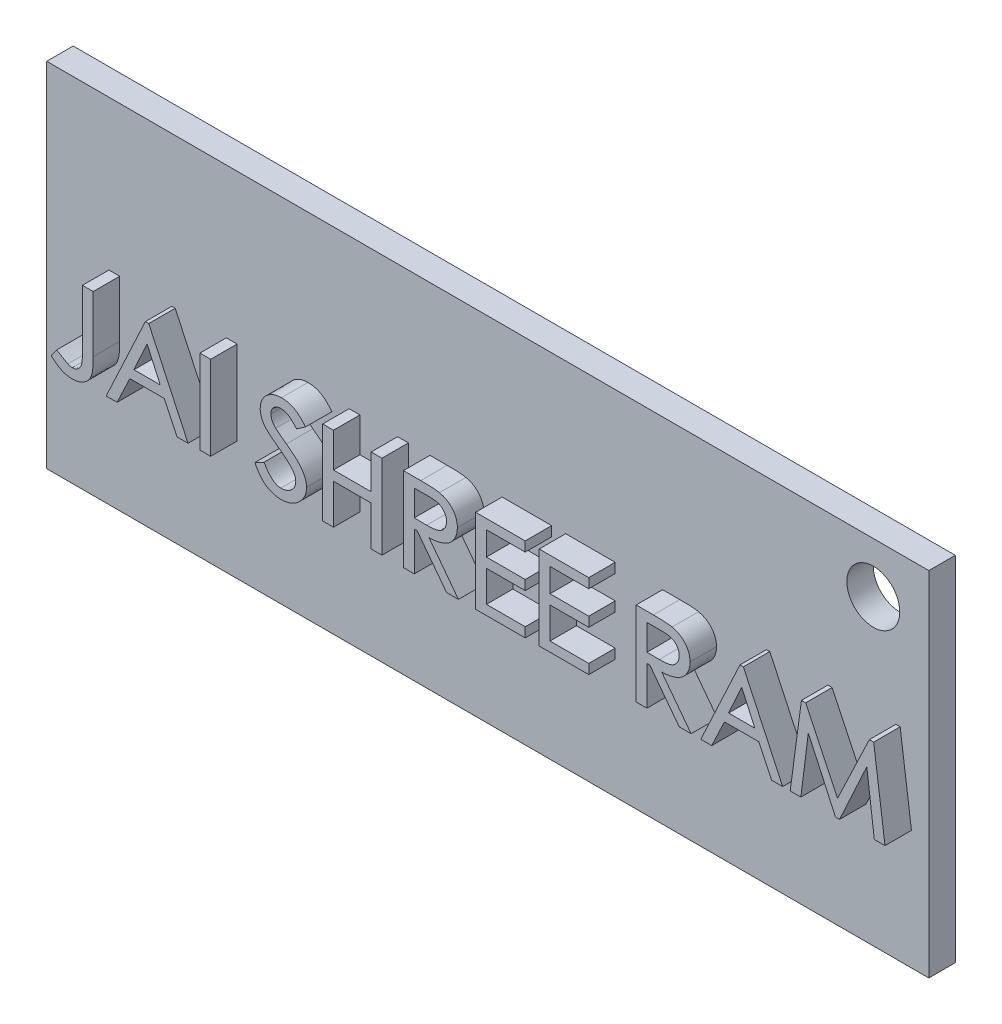
from build123d import *

# Parameters (mm, degrees)
SKETCH1_W           = 50
SKETCH1_H           = 20
BOSS_EXTRUDE1_DEPTH = 2
SKETCH2_W           = 0.610576923
SKETCH2_H           = 4.7625
BOSS_EXTRUDE2_DEPTH = 1.5
SKETCH3_R           = 1.5
CUT_EXTRUDE1_DEPTH  = 4.5
SKETCH4_W           = 50
SKETCH4_H           = 20
CUT_EXTRUDE2_DEPTH  = 0.5


with BuildPart() as part:
    # Sketch1 → Boss-Extrude1 (new body)
    with BuildSketch(Plane.XY):
        with Locations((25, 10)):
            Rectangle(SKETCH1_W, SKETCH1_H)
    extrude(amount=BOSS_EXTRUDE1_DEPTH)

    # Sketch2 → Boss-Extrude2 (add)
    # profile 1 of 11: a face of its own
    with BuildSketch(Plane.XY.offset(2)):
        with BuildLine():
            Line((3.527254375, 11.517482199), (4.137831298, 11.517482199))
            Line((4.137831298, 11.517482199), (4.137831298, 8.320539591))
            add(Edge.make_bspline(
                [(4.137831298, 8.320539591), (4.137369393, 8.262660957), (4.13648095, 8.151335463), (4.132416587, 7.99095202), (4.122616108, 7.844316911), (4.110067042, 7.710736069), (4.09603917, 7.590135007), (4.075453027, 7.483013293), (4.053433263, 7.388994498), (4.017799839, 7.282359586), (3.961605704, 7.162646856), (3.872103401, 7.033555286), (3.760947677, 6.918559061), (3.652980666, 6.834614431), (3.556960451, 6.776969252), (3.48065281, 6.737208328), (3.399393736, 6.704920072), (3.313923276, 6.679584233), (3.225148985, 6.658341294), (3.132109712, 6.642912946), (3.034817254, 6.634515846), (2.968528246, 6.633422865), (2.934803954, 6.632866814)],
                knots=[0, 0, 0, 0, 1.452672516, 2.794113746, 4.025812556, 5.140045592, 6.161674878, 7.071150553, 7.876425152, 8.583113845, 9.889795866, 11.180512384, 12.507055147, 13.889560834, 14.598589264, 15.316057477, 16.046722018, 16.789019803, 17.55176036, 18.336401437, 19.153650307, 20, 20, 20, 20], degree=3))
            add(Edge.make_bspline(
                [(2.934803954, 6.632866814), (2.887334041, 6.63402819), (2.792876699, 6.636339136), (2.652114658, 6.658874722), (2.512938035, 6.692590077), (2.372837363, 6.742528317), (2.228947091, 6.812574312), (2.079287645, 6.909339163), (1.918425168, 7.028562107), (1.812493314, 7.121751385), (1.756581298, 7.170937728)],
                knots=[0, 0, 0, 0, 0.856854487, 1.704999893, 2.568796624, 3.440919207, 4.38635173, 5.452546826, 6.655425746, 8, 8, 8, 8], degree=3))
            Line((1.756581298, 7.170937728), (2.05900768, 7.609789891))
            add(Edge.make_bspline(
                [(2.05900768, 7.609789891), (2.094243339, 7.587743898), (2.162260112, 7.545187655), (2.261397435, 7.485466107), (2.35258942, 7.430712574), (2.437087884, 7.383307051), (2.51313558, 7.340207095), (2.581538597, 7.302728568), (2.643201114, 7.272064266), (2.68195667, 7.253873889), (2.70011345, 7.24535179)],
                knots=[0, 0, 0, 0, 1.351848167, 2.609525467, 3.764319947, 4.811191365, 5.760578872, 6.607529217, 7.347634558, 8, 8, 8, 8], degree=3))
            add(Edge.make_bspline(
                [(2.70011345, 7.24535179), (2.722821183, 7.235590967), (2.766264683, 7.216916963), (2.83179995, 7.198545083), (2.892873988, 7.184540554), (2.932824875, 7.183084192), (2.95197643, 7.182386045)],
                knots=[0, 0, 0, 0, 1.133394633, 2.168363871, 3.121954873, 4, 4, 4, 4], degree=3))
            add(Edge.make_bspline(
                [(2.95197643, 7.182386045), (2.980397875, 7.183642245), (3.036693453, 7.186130453), (3.118702225, 7.206899704), (3.196239144, 7.240957048), (3.268787802, 7.287861682), (3.334339367, 7.346651255), (3.390420482, 7.416706798), (3.43665223, 7.496261044), (3.464964578, 7.571731165), (3.484408123, 7.640937826), (3.494500609, 7.705701261), (3.50548769, 7.781610418), (3.513940385, 7.869146009), (3.518917352, 7.968476668), (3.524056469, 8.07944528), (3.526725069, 8.201909455), (3.527073208, 8.287465715), (3.527254375, 8.331987908)],
                knots=[0, 0, 0, 0, 0.93789549, 1.85772999, 2.77510142, 3.725098534, 4.6996409, 5.670950193, 6.678238788, 7.725916441, 8.324833892, 9.050260382, 9.888218126, 10.859356959, 11.953767278, 13.173560852, 14.529163492, 16, 16, 16, 16], degree=3))
            Line((3.527254375, 8.331987908), (3.527254375, 11.517482199))
        make_face()
    # profile 2 of 11: a face of its own
    with BuildSketch(Plane.XY.offset(2)):
        Polygon((7.282302452, 11.517482199), (9.510908221, 6.754982199), (8.884112849, 6.754982199), (8.160960805, 8.281424506), (6.21283881, 8.281424506), (5.489686767, 6.754982199), (4.870523606, 6.754982199), (7.091497164, 11.517482199), align=None)
        Polygon((7.186899808, 10.47663935), (6.445621262, 8.830943737), (7.935810565, 8.830943737), align=None, mode=Mode.SUBTRACT)
    # profile 3 of 11: a face of its own
    with BuildSketch(Plane.XY.offset(2)):
        with Locations((10.487831299, 9.136232199)):
            Rectangle(SKETCH2_W, SKETCH2_H)
    # profile 4 of 11: a face of its own
    with BuildSketch(Plane.XY.offset(2)):
        with BuildLine():
            Line((13.296485144, 7.699468377), (13.815475529, 7.976136045))
            add(Edge.make_bspline(
                [(13.815475529, 7.976136045), (13.853297278, 7.913487235), (13.925585119, 7.793748002), (14.044285423, 7.632445041), (14.162305675, 7.494896007), (14.280810874, 7.381239783), (14.40144715, 7.293302025), (14.522982939, 7.22974757), (14.646178909, 7.189801482), (14.729475682, 7.184831282), (14.770455998, 7.182386045)],
                knots=[0, 0, 0, 0, 1.354943589, 2.589672558, 3.704607527, 4.708856974, 5.624398268, 6.459549776, 7.242129862, 8, 8, 8, 8], degree=3))
            add(Edge.make_bspline(
                [(14.770455998, 7.182386045), (14.808713328, 7.183615795), (14.884490093, 7.186051576), (14.995829279, 7.207175797), (15.103635091, 7.239361662), (15.206039454, 7.285193621), (15.300647019, 7.341343391), (15.384164702, 7.408131134), (15.455027128, 7.483744702), (15.513434194, 7.567158344), (15.559217138, 7.656218715), (15.592920412, 7.748398655), (15.612700871, 7.843963768), (15.615342261, 7.908310553), (15.616677452, 7.940837067)],
                knots=[0, 0, 0, 0, 1.0888553, 2.156709112, 3.216967111, 4.287545289, 5.343926646, 6.34269433, 7.323221176, 8.28571565, 9.233736345, 10.167849744, 11.073870434, 12, 12, 12, 12], degree=3))
            add(Edge.make_bspline(
                [(15.616677452, 7.940837067), (15.614806725, 7.977907025), (15.611026413, 8.052816933), (15.580684717, 8.164096495), (15.531373922, 8.274287239), (15.485760325, 8.343086273), (15.462125168, 8.378735204)],
                knots=[0, 0, 0, 0, 0.941861274, 1.903286225, 2.913566088, 4, 4, 4, 4], degree=3))
            add(Edge.make_bspline(
                [(15.462125168, 8.378735204), (15.441687758, 8.404685037), (15.398665274, 8.45931164), (15.325840411, 8.54155284), (15.240625764, 8.627342613), (15.143159563, 8.716293931), (15.035154972, 8.810399927), (14.914777355, 8.907228383), (14.782877697, 9.008415716), (14.690446078, 9.076300092), (14.642616454, 9.111427511)],
                knots=[0, 0, 0, 0, 0.718593868, 1.512701116, 2.388487339, 3.348232282, 4.383172848, 5.504845107, 6.708858268, 8, 8, 8, 8], degree=3))
            add(Edge.make_bspline(
                [(14.642616454, 9.111427511), (14.593842757, 9.146884412), (14.50025969, 9.214916277), (14.36840932, 9.314651305), (14.25019263, 9.406612528), (14.146516153, 9.490871822), (14.057368105, 9.568161532), (13.982936283, 9.638164504), (13.920979981, 9.698959673), (13.887686431, 9.739865515), (13.872717115, 9.758257439)],
                knots=[0, 0, 0, 0, 1.435833971, 2.754963323, 3.936484598, 5.002077172, 5.935979083, 6.744956812, 7.435712417, 8, 8, 8, 8], degree=3))
            add(Edge.make_bspline(
                [(13.872717115, 9.758257439), (13.850863938, 9.786493871), (13.807931613, 9.841966613), (13.753577804, 9.930948484), (13.706807568, 10.02109492), (13.668285344, 10.113240621), (13.63843294, 10.207091213), (13.617895897, 10.302975824), (13.603409424, 10.400513579), (13.602320843, 10.466409626), (13.601773606, 10.499535985)],
                knots=[0, 0, 0, 0, 1.064105702, 2.090521257, 3.104283852, 4.09061442, 5.065433238, 6.036507983, 7.012940167, 8, 8, 8, 8], degree=3))
            add(Edge.make_bspline(
                [(13.601773606, 10.499535985), (13.603496921, 10.551195989), (13.606908959, 10.653479017), (13.637400218, 10.802796916), (13.686811828, 10.945070206), (13.754258151, 11.079563557), (13.840385876, 11.2037735), (13.942831305, 11.315247028), (14.062148739, 11.41160551), (14.195154584, 11.49279773), (14.338519204, 11.55864516), (14.489515746, 11.605578193), (14.646313715, 11.634030659), (14.752847711, 11.637728191), (14.806709003, 11.639597583)],
                knots=[0, 0, 0, 0, 1.004530234, 1.988896367, 2.951881425, 3.928924249, 4.907494835, 5.884204368, 6.865296418, 7.88218147, 8.909671266, 9.927572845, 10.952225504, 12, 12, 12, 12], degree=3))
            add(Edge.make_bspline(
                [(14.806709003, 11.639597583), (14.867865426, 11.637408575), (14.988986018, 11.633073234), (15.167529157, 11.603693325), (15.338260262, 11.550796818), (15.475765326, 11.492408897), (15.582581607, 11.432711845), (15.663368946, 11.378795187), (15.746171802, 11.31777688), (15.828367563, 11.246615208), (15.913159773, 11.16875324), (15.99620639, 11.079958578), (16.082762996, 10.985320155), (16.137931008, 10.917069325), (16.166196683, 10.882100588)],
                knots=[0, 0, 0, 0, 1.360590218, 2.69465552, 4.010645498, 5.328858611, 6.009843139, 6.729980544, 7.488405022, 8.296451933, 9.147430815, 10.048128915, 10.999946711, 12, 12, 12, 12], degree=3))
            Line((16.166196683, 10.882100588), (15.66819488, 10.540559122))
            add(Edge.make_bspline(
                [(15.66819488, 10.540559122), (15.642205515, 10.56830873), (15.592234488, 10.621664262), (15.518728145, 10.69733056), (15.449181122, 10.765235654), (15.383382354, 10.825068901), (15.322806627, 10.87789735), (15.265751819, 10.921939615), (15.214002106, 10.959791942), (15.149310374, 10.997307774), (15.070003191, 11.034462896), (14.972394659, 11.067893982), (14.870007512, 11.085760843), (14.800728195, 11.088628073), (14.765685865, 11.090078353)],
                knots=[0, 0, 0, 0, 1.253377364, 2.409930098, 3.477532466, 4.457083962, 5.341772995, 6.126101147, 6.832963523, 7.453284126, 8.588253012, 9.715448048, 10.844445545, 12, 12, 12, 12], degree=3))
            add(Edge.make_bspline(
                [(14.765685865, 11.090078353), (14.72828192, 11.088330388), (14.655565595, 11.084932203), (14.551112408, 11.055832463), (14.455094678, 11.009914066), (14.37038012, 10.944927238), (14.29996803, 10.864490945), (14.24832921, 10.770270017), (14.21810875, 10.662892745), (14.214324105, 10.587504154), (14.212350529, 10.548191333)],
                knots=[0, 0, 0, 0, 1.033513523, 2.009234674, 2.977584268, 3.963375862, 4.942860848, 5.915719707, 6.913112236, 8, 8, 8, 8], degree=3))
            add(Edge.make_bspline(
                [(14.212350529, 10.548191333), (14.213119496, 10.522717892), (14.214655569, 10.471832623), (14.225938461, 10.396457071), (14.246794881, 10.323626407), (14.27322418, 10.251805534), (14.310216144, 10.181397997), (14.357327617, 10.112292619), (14.413253285, 10.042498477), (14.456174179, 9.998622517), (14.478523906, 9.975775468)],
                knots=[0, 0, 0, 0, 0.940834015, 1.879392378, 2.805520916, 3.734846727, 4.701501436, 5.734192883, 6.820151034, 8, 8, 8, 8], degree=3))
            add(Edge.make_bspline(
                [(14.478523906, 9.975775468), (14.489840525, 9.965129351), (14.515814539, 9.940694279), (14.563453669, 9.903276936), (14.621494523, 9.856365584), (14.690741754, 9.800725897), (14.773472367, 9.739378639), (14.866627519, 9.668225306), (14.972565906, 9.590469142), (15.047115046, 9.535956795), (15.08623875, 9.507348485)],
                knots=[0, 0, 0, 0, 0.485581606, 1.114511607, 1.892484918, 2.819534315, 3.891398566, 5.11240712, 6.484579029, 8, 8, 8, 8], degree=3))
            add(Edge.make_bspline(
                [(15.08623875, 9.507348485), (15.139540385, 9.468497049), (15.242654255, 9.393337592), (15.389131047, 9.279969443), (15.521232426, 9.168840772), (15.642298231, 9.063828599), (15.748234223, 8.96052787), (15.841025284, 8.861062572), (15.921836694, 8.766403562), (16.00814425, 8.645715972), (16.094434505, 8.496928909), (16.171595827, 8.317091787), (16.217640407, 8.135835962), (16.224077319, 8.014858234), (16.227254375, 7.955147463)],
                knots=[0, 0, 0, 0, 1.186540699, 2.295404303, 3.331123753, 4.291760032, 5.17774712, 5.991329992, 6.738459906, 7.414799035, 8.65800623, 9.82461674, 10.926299804, 12, 12, 12, 12], degree=3))
            add(Edge.make_bspline(
                [(16.227254375, 7.955147463), (16.22590255, 7.912783542), (16.223215693, 7.828582009), (16.203735241, 7.704084653), (16.171321482, 7.583077493), (16.124688417, 7.466071502), (16.066523258, 7.351968548), (15.994402352, 7.241766191), (15.908560774, 7.135889084), (15.81262004, 7.033697451), (15.706533811, 6.939779355), (15.592768374, 6.857119044), (15.471671064, 6.78806508), (15.344175044, 6.732039775), (15.211028401, 6.68638611), (15.070915339, 6.655117168), (14.924528839, 6.637068273), (14.824885458, 6.634282058), (14.774272103, 6.632866814)],
                knots=[0, 0, 0, 0, 0.932646097, 1.853705421, 2.767602683, 3.685675702, 4.622099834, 5.5835355, 6.579838097, 7.620108014, 8.666886363, 9.695041649, 10.711275682, 11.730160242, 12.757671447, 13.80585424, 14.885494678, 16, 16, 16, 16], degree=3))
            add(Edge.make_bspline(
                [(14.774272103, 6.632866814), (14.73736427, 6.633686584), (14.6646711, 6.635301192), (14.556752446, 6.645542939), (14.451734154, 6.665227475), (14.349040442, 6.690677597), (14.248607218, 6.723084891), (14.151728788, 6.764539761), (14.056791902, 6.812156409), (13.964341164, 6.86791057), (13.87425868, 6.933194304), (13.786032525, 7.008975878), (13.700175182, 7.096587439), (13.615214874, 7.194890728), (13.532274039, 7.304991455), (13.451546311, 7.426310673), (13.372000943, 7.558457163), (13.322153222, 7.651538184), (13.296485144, 7.699468377)],
                knots=[0, 0, 0, 0, 0.916943493, 1.805999526, 2.689245248, 3.568702553, 4.433092864, 5.307568578, 6.183755457, 7.069823058, 7.986358083, 8.944343836, 9.955449961, 11.030835633, 12.170024038, 13.377301724, 14.649494474, 16, 16, 16, 16], degree=3))
        make_face()
    # profile 5 of 11: a face of its own
    with BuildSketch(Plane.XY.offset(2)):
        Polygon((17.14311976, 11.517482199), (17.753696683, 11.517482199), (17.753696683, 9.563636045), (19.890715914, 9.563636045), (19.890715914, 11.517482199), (20.501292837, 11.517482199), (20.501292837, 6.754982199), (19.890715914, 6.754982199), (19.890715914, 9.014116814), (17.753696683, 9.014116814), (17.753696683, 6.754982199), (17.14311976, 6.754982199), align=None)
    # profile 6 of 11: a face of its own
    with BuildSketch(Plane.XY.offset(2)):
        with BuildLine():
            Line((21.722446683, 11.517482199), (22.697461707, 11.517482199))
            add(Edge.make_bspline(
                [(22.697461707, 11.517482199), (22.760111442, 11.517330717), (22.880011801, 11.517040808), (23.052059316, 11.513998608), (23.208273882, 11.509969483), (23.348773564, 11.501553226), (23.473934602, 11.494124319), (23.583215655, 11.481905848), (23.677131227, 11.471008294), (23.733596175, 11.459018797), (23.759293137, 11.453562427)],
                knots=[0, 0, 0, 0, 1.411347063, 2.701065231, 3.876524531, 4.931206492, 5.871916627, 6.700262025, 7.408494688, 8, 8, 8, 8], degree=3))
            add(Edge.make_bspline(
                [(23.759293137, 11.453562427), (23.797609265, 11.443930236), (23.873097873, 11.424953354), (23.981854202, 11.387591894), (24.084529913, 11.343545412), (24.180989676, 11.293056168), (24.27146542, 11.23587056), (24.354206742, 11.170263431), (24.432473157, 11.099586055), (24.503244763, 11.021621007), (24.567636221, 10.938714384), (24.622692604, 10.850880797), (24.669931465, 10.759299855), (24.709357613, 10.664107693), (24.738837195, 10.564242781), (24.759485933, 10.46044011), (24.773696574, 10.353007967), (24.774782918, 10.279838462), (24.775331298, 10.242902872)],
                knots=[0, 0, 0, 0, 1.103820101, 2.174693741, 3.209859002, 4.223626675, 5.214778413, 6.196198804, 7.171320727, 8.158999421, 9.134971582, 10.10159085, 11.051641808, 12.012235658, 12.97676874, 13.956376421, 14.968389326, 16, 16, 16, 16], degree=3))
            add(Edge.make_bspline(
                [(24.775331298, 10.242902872), (24.773289879, 10.18198785), (24.7692778, 10.062269253), (24.732815959, 9.887668638), (24.673065252, 9.723081987), (24.604913378, 9.594510838), (24.538613859, 9.498926048), (24.483106621, 9.430972596), (24.422082441, 9.367310699), (24.355974018, 9.307277576), (24.283041607, 9.253526133), (24.205510119, 9.202561352), (24.122464962, 9.155710345), (24.002759818, 9.099454092), (23.840851596, 9.040819211), (23.6316538, 8.990551433), (23.40559974, 8.960017243), (23.249303828, 8.9554256), (23.168750769, 8.953059122)],
                knots=[0, 0, 0, 0, 1.258986715, 2.474334223, 3.670931197, 4.871716255, 5.472099774, 6.075216246, 6.684756624, 7.295006596, 7.919971941, 8.55677058, 9.213641309, 9.890468445, 11.291088691, 12.766994829, 14.333747493, 16, 16, 16, 16], degree=3))
            Line((23.168750769, 8.953059122), (24.83638899, 6.754982199))
            Line((24.83638899, 6.754982199), (24.163800349, 6.754982199))
            Line((24.163800349, 6.754982199), (22.496162128, 8.953059122))
            Line((22.496162128, 8.953059122), (22.333023606, 8.953059122))
            Line((22.333023606, 8.953059122), (22.333023606, 6.754982199))
            Line((22.333023606, 6.754982199), (21.722446683, 6.754982199))
            Line((21.722446683, 6.754982199), (21.722446683, 11.517482199))
        make_face()
        with BuildLine():
            Line((22.333023606, 10.967962968), (22.333023606, 9.501624326))
            Line((22.333023606, 9.501624326), (23.033279015, 9.496854194))
            add(Edge.make_bspline(
                [(23.033279015, 9.496854194), (23.07080757, 9.49695116), (23.143342239, 9.497138575), (23.248334915, 9.500997688), (23.345718156, 9.507459886), (23.435107292, 9.517030784), (23.516243048, 9.528449188), (23.589747357, 9.541237896), (23.654930028, 9.558506735), (23.731071573, 9.583399139), (23.815665788, 9.623391141), (23.905404572, 9.684280625), (23.984063785, 9.756341836), (24.048568412, 9.840778827), (24.100179012, 9.933415504), (24.137724543, 10.032323596), (24.160341689, 10.136945591), (24.163266737, 10.208446558), (24.164754375, 10.244810925)],
                knots=[0, 0, 0, 0, 1.165824803, 2.253289887, 3.263370799, 4.197285623, 5.045371766, 5.808848116, 6.513348392, 7.138183875, 8.296069948, 9.40583476, 10.496436725, 11.595152671, 12.691956992, 13.780050175, 14.870965332, 16, 16, 16, 16], degree=3))
            add(Edge.make_bspline(
                [(24.164754375, 10.244810925), (24.16319636, 10.279889523), (24.160106095, 10.349466604), (24.138126805, 10.451579843), (24.098839492, 10.547913764), (24.046714171, 10.638344537), (23.982128376, 10.719640938), (23.907853238, 10.791277094), (23.822050048, 10.848058718), (23.743055224, 10.886382497), (23.67225852, 10.910417733), (23.609571003, 10.925260884), (23.538218283, 10.938367004), (23.458054572, 10.94988618), (23.369228024, 10.95830221), (23.271517065, 10.963596987), (23.164969914, 10.967757174), (23.090843312, 10.967892639), (23.052359543, 10.967962968)],
                knots=[0, 0, 0, 0, 1.114111647, 2.20979856, 3.297775031, 4.406653707, 5.514151176, 6.585969385, 7.670234779, 8.768154562, 9.365517569, 10.041721951, 10.812428959, 11.669578816, 12.61341719, 13.645562296, 14.777663698, 16, 16, 16, 16], degree=3))
            Line((23.052359543, 10.967962968), (22.333023606, 10.967962968))
        make_face(mode=Mode.SUBTRACT)
    # profile 7 of 11: a face of its own
    with BuildSketch(Plane.XY.offset(2)):
        Polygon((25.813312067, 11.517482199), (28.621965914, 11.517482199), (28.621965914, 10.967962968), (26.42388899, 10.967962968), (26.42388899, 9.624693737), (28.621965914, 9.624693737), (28.621965914, 9.075174506), (26.42388899, 9.075174506), (26.42388899, 7.304501429), (28.621965914, 7.304501429), (28.621965914, 6.754982199), (25.813312067, 6.754982199), align=None)
    # profile 8 of 11: a face of its own
    with BuildSketch(Plane.XY.offset(2)):
        Polygon((29.415715914, 11.517482199), (32.22436976, 11.517482199), (32.22436976, 10.967962968), (30.026292837, 10.967962968), (30.026292837, 9.624693737), (32.22436976, 9.624693737), (32.22436976, 9.075174506), (30.026292837, 9.075174506), (30.026292837, 7.304501429), (32.22436976, 7.304501429), (32.22436976, 6.754982199), (29.415715914, 6.754982199), align=None)
    # profile 9 of 11: a face of its own
    with BuildSketch(Plane.XY.offset(2)):
        with BuildLine():
            Line((34.910908221, 11.517482199), (35.885923245, 11.517482199))
            add(Edge.make_bspline(
                [(35.885923245, 11.517482199), (35.94857298, 11.517330717), (36.06847334, 11.517040808), (36.240520855, 11.513998608), (36.396735421, 11.509969483), (36.537235103, 11.501553226), (36.66239614, 11.494124319), (36.771677193, 11.481905848), (36.865592765, 11.471008294), (36.922057714, 11.459018797), (36.947754676, 11.453562427)],
                knots=[0, 0, 0, 0, 1.411347063, 2.701065231, 3.876524531, 4.931206492, 5.871916627, 6.700262025, 7.408494688, 8, 8, 8, 8], degree=3))
            add(Edge.make_bspline(
                [(36.947754676, 11.453562427), (36.986070803, 11.443930236), (37.061559411, 11.424953354), (37.170315741, 11.387591894), (37.272991451, 11.343545412), (37.369451214, 11.293056168), (37.459926958, 11.23587056), (37.542668281, 11.170263431), (37.620934695, 11.099586055), (37.691706302, 11.021621007), (37.75609776, 10.938714384), (37.811154142, 10.850880797), (37.858393004, 10.759299855), (37.897819151, 10.664107693), (37.927298733, 10.564242781), (37.947947472, 10.46044011), (37.962158113, 10.353007967), (37.963244456, 10.279838462), (37.963792837, 10.242902872)],
                knots=[0, 0, 0, 0, 1.103820101, 2.174693741, 3.209859002, 4.223626675, 5.214778413, 6.196198804, 7.171320727, 8.158999421, 9.134971582, 10.10159085, 11.051641808, 12.012235658, 12.97676874, 13.956376421, 14.968389326, 16, 16, 16, 16], degree=3))
            add(Edge.make_bspline(
                [(37.963792837, 10.242902872), (37.961751417, 10.18198785), (37.957739339, 10.062269253), (37.921277497, 9.887668638), (37.861526791, 9.723081987), (37.793374917, 9.594510838), (37.727075398, 9.498926048), (37.671568159, 9.430972596), (37.610543979, 9.367310699), (37.544435556, 9.307277576), (37.471503146, 9.253526133), (37.393971657, 9.202561352), (37.310926501, 9.155710345), (37.191221356, 9.099454092), (37.029313134, 9.040819211), (36.820115339, 8.990551433), (36.594061279, 8.960017243), (36.437765366, 8.9554256), (36.357212308, 8.953059122)],
                knots=[0, 0, 0, 0, 1.258986715, 2.474334223, 3.670931197, 4.871716255, 5.472099774, 6.075216246, 6.684756624, 7.295006596, 7.919971941, 8.55677058, 9.213641309, 9.890468445, 11.291088691, 12.766994829, 14.333747493, 16, 16, 16, 16], degree=3))
            Line((36.357212308, 8.953059122), (38.024850529, 6.754982199))
            Line((38.024850529, 6.754982199), (37.352261887, 6.754982199))
            Line((37.352261887, 6.754982199), (35.684623666, 8.953059122))
            Line((35.684623666, 8.953059122), (35.521485144, 8.953059122))
            Line((35.521485144, 8.953059122), (35.521485144, 6.754982199))
            Line((35.521485144, 6.754982199), (34.910908221, 6.754982199))
            Line((34.910908221, 6.754982199), (34.910908221, 11.517482199))
        make_face()
        with BuildLine():
            Line((35.521485144, 10.967962968), (35.521485144, 9.501624326))
            Line((35.521485144, 9.501624326), (36.221740553, 9.496854194))
            add(Edge.make_bspline(
                [(36.221740553, 9.496854194), (36.259269109, 9.49695116), (36.331803777, 9.497138575), (36.436796453, 9.500997688), (36.534179695, 9.507459886), (36.62356883, 9.517030784), (36.704704587, 9.528449188), (36.778208896, 9.541237896), (36.843391566, 9.558506735), (36.919533111, 9.583399139), (37.004127326, 9.623391141), (37.093866111, 9.684280625), (37.172525323, 9.756341836), (37.237029951, 9.840778827), (37.28864055, 9.933415504), (37.326186081, 10.032323596), (37.348803227, 10.136945591), (37.351728276, 10.208446558), (37.353215914, 10.244810925)],
                knots=[0, 0, 0, 0, 1.165824803, 2.253289887, 3.263370799, 4.197285623, 5.045371766, 5.808848116, 6.513348392, 7.138183875, 8.296069948, 9.40583476, 10.496436725, 11.595152671, 12.691956992, 13.780050175, 14.870965332, 16, 16, 16, 16], degree=3))
            add(Edge.make_bspline(
                [(37.353215914, 10.244810925), (37.351657898, 10.279889523), (37.348567633, 10.349466604), (37.326588344, 10.451579843), (37.287301031, 10.547913764), (37.235175709, 10.638344537), (37.170589915, 10.719640938), (37.096314777, 10.791277094), (37.010511587, 10.848058718), (36.931516763, 10.886382497), (36.860720059, 10.910417733), (36.798032542, 10.925260884), (36.726679821, 10.938367004), (36.64651611, 10.94988618), (36.557689562, 10.95830221), (36.459978603, 10.963596987), (36.353431452, 10.967757174), (36.279304851, 10.967892639), (36.240821082, 10.967962968)],
                knots=[0, 0, 0, 0, 1.114111647, 2.20979856, 3.297775031, 4.406653707, 5.514151176, 6.585969385, 7.670234779, 8.768154562, 9.365517569, 10.041721951, 10.812428959, 11.669578816, 12.61341719, 13.645562296, 14.777663698, 16, 16, 16, 16], degree=3))
            Line((36.240821082, 10.967962968), (35.521485144, 10.967962968))
        make_face(mode=Mode.SUBTRACT)
    # profile 10 of 11: a face of its own
    with BuildSketch(Plane.XY.offset(2)):
        Polygon((40.986148606, 11.517482199), (43.214754375, 6.754982199), (42.587959003, 6.754982199), (41.864806959, 8.281424506), (39.916684964, 8.281424506), (39.193532921, 6.754982199), (38.57436976, 6.754982199), (40.795343317, 11.517482199), align=None)
        Polygon((40.890745962, 10.47663935), (40.149467416, 8.830943737), (41.639656719, 8.830943737), align=None, mode=Mode.SUBTRACT)
    # profile 11 of 11: a face of its own
    with BuildSketch(Plane.XY.offset(2)):
        Polygon((43.642158221, 6.754982199), (44.278493858, 11.517482199), (44.518908522, 11.517482199), (46.324880577, 7.731905276), (48.130852632, 11.517482199), (48.375083402, 11.517482199), (49.015235144, 6.754982199), (48.409428353, 6.754982199), (47.985840613, 10.113155276), (46.440317777, 6.754982199), (46.209443378, 6.754982199), (44.668690673, 10.113155276), (44.247010986, 6.754982199), align=None)
    extrude(amount=BOSS_EXTRUDE2_DEPTH)

    # Sketch3 → Cut-Extrude1 (cut)
    with BuildSketch(Plane.XY.offset(2)):
        with Locations((46.853682954, 17.142921712)):
            Circle(SKETCH3_R)
    extrude(amount=-CUT_EXTRUDE1_DEPTH, mode=Mode.SUBTRACT)

    # Sketch4 → Cut-Extrude2 (cut)
    with BuildSketch(Plane(origin=(0, 0, 0), x_dir=(-1, 0, 0), z_dir=(0, 0, -1))):
        with Locations((-25, 10)):
            Rectangle(SKETCH4_W, SKETCH4_H)
    extrude(amount=-CUT_EXTRUDE2_DEPTH, mode=Mode.SUBTRACT)


solid = part.part
